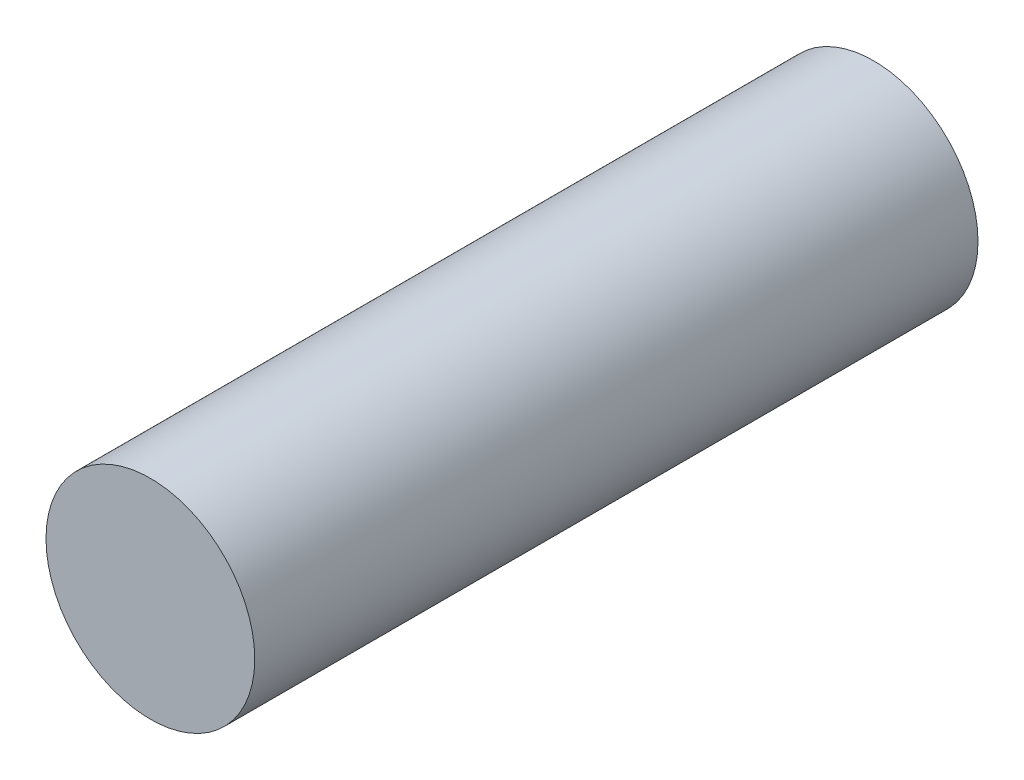
from build123d import *

# Parameters (mm, degrees)
SKETCH1_R           = 3.175
BOSS_EXTRUDE1_DEPTH = 22


with BuildPart() as part:
    # Sketch1 → Boss-Extrude1 (new body)
    with BuildSketch(Plane.XY):
        Circle(SKETCH1_R)
    extrude(amount=BOSS_EXTRUDE1_DEPTH)


solid = part.part
